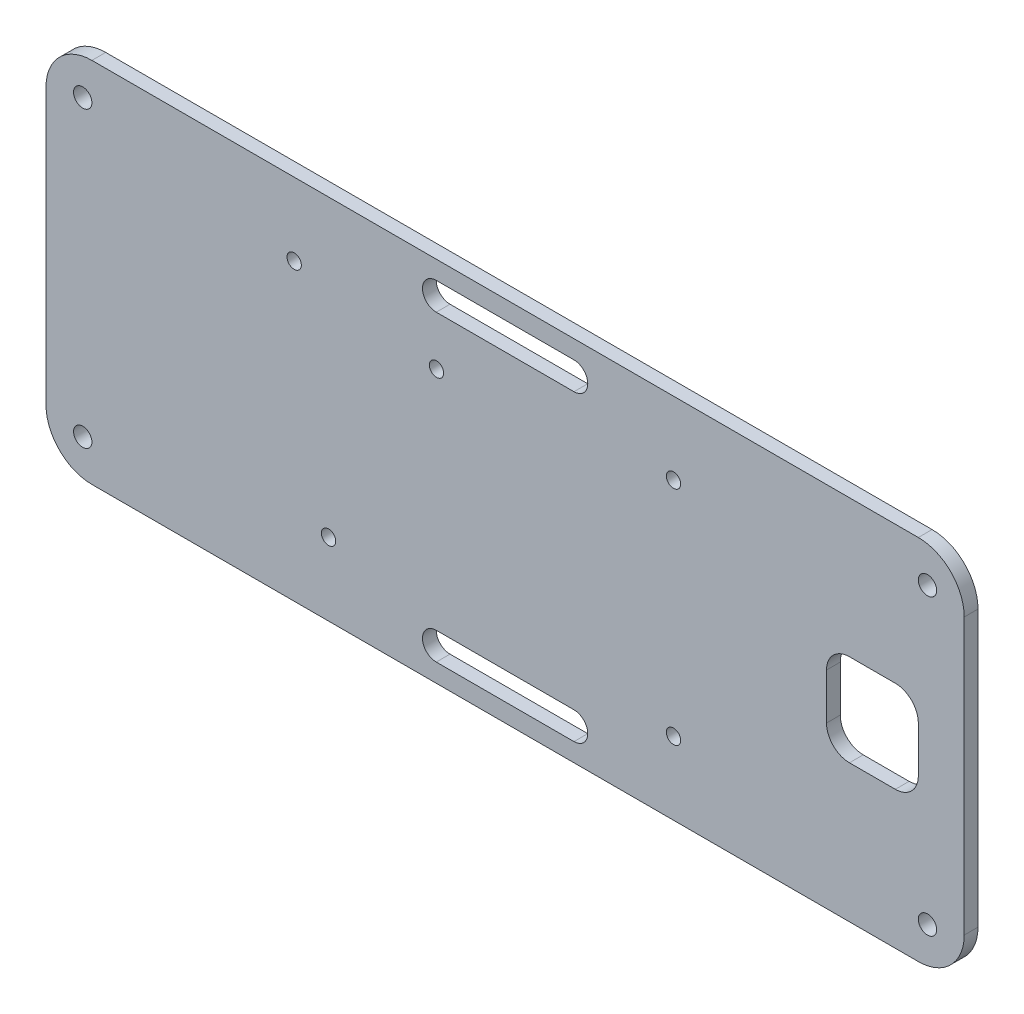
from build123d import *

# Parameters (mm, degrees)
SKETCH1_W           = 200
SKETCH1_H           = 80
BOSS_EXTRUDE1_DEPTH = 3
SKETCH2_R           = 2
CUT_EXTRUDE1_DEPTH  = 108.745069493
FILLET1_R           = 10
SKETCH3_R           = 1.5621
CUT_EXTRUDE2_DEPTH  = 108.745069493
SKETCH4_W           = 20
SKETCH4_H           = 20
CUT_EXTRUDE3_DEPTH  = 108.745069493
FILLET2_R           = 5
CUT_EXTRUDE4_DEPTH  = 108.745069493


with BuildPart() as part:
    # Sketch1 → Boss-Extrude1 (new body)
    with BuildSketch(Plane.XY):
        Rectangle(SKETCH1_W, SKETCH1_H)
    extrude(amount=BOSS_EXTRUDE1_DEPTH)

    # Sketch2 → Cut-Extrude1 (cut, through all)
    with BuildSketch(Plane.XY.offset(3)):
        with Locations((-92, 32)):
            Circle(SKETCH2_R)
        with Locations(Location((-92, -32, 0), (0, 0, 180))):
            Circle(SKETCH2_R)
        with Locations((92, -32)):
            Circle(SKETCH2_R)
        with Locations(Location((92, 32, 0), (0, 0, 180))):
            Circle(SKETCH2_R)
    extrude(amount=-CUT_EXTRUDE1_DEPTH, mode=Mode.SUBTRACT)

    # Fillet1
    fillet1_edges = [part.edges().sort_by_distance(p)[0] for p in [
        (100, -40, 1.5),
        (-100, -40, 1.5),
        (-100, 40, 1.5),
        (100, 40, 1.5),
    ]]
    fillet(fillet1_edges, radius=FILLET1_R)

    # Sketch3 → Cut-Extrude2 (cut, through all)
    with BuildSketch(Plane.XY.offset(3)):
        with Locations((36.6776, 24.1681)):
            Circle(SKETCH3_R)
        with Locations((36.6776, -24.1681)):
            Circle(SKETCH3_R)
        with Locations((-38.4556, -24.1681)):
            Circle(SKETCH3_R)
        with Locations((-45.9486, 24.1681)):
            Circle(SKETCH3_R)
        with Locations((-14.9479, 19.289607234)):
            Circle(SKETCH3_R)
    extrude(amount=-CUT_EXTRUDE2_DEPTH, mode=Mode.SUBTRACT)

    # Sketch4 → Cut-Extrude3 (cut, through all)
    with BuildSketch(Plane.XY.offset(3)):
        with Locations((80, 0)):
            Rectangle(SKETCH4_W, SKETCH4_H)
    extrude(amount=-CUT_EXTRUDE3_DEPTH, mode=Mode.SUBTRACT)

    # Fillet2
    fillet2_edges = [part.edges().sort_by_distance(p)[0] for p in [
        (90, 10, 1.5),
        (90, -10, 1.5),
        (70, -10, 1.5),
        (70, 10, 1.5),
    ]]
    fillet(fillet2_edges, radius=FILLET2_R)

    # Sketch5 → Cut-Extrude4 (cut, through all)
    with BuildSketch(Plane.XY.offset(3)):
        with BuildLine():
            Line((-15, -30), (15, -30))
            ThreePointArc((15, -30), (18, -33), (15, -36))
            Line((15, -36), (-15, -36))
            ThreePointArc((-15, -36), (-18, -33), (-15, -30))
        make_face()
        with BuildLine():
            Line((-15, 30), (15, 30))
            ThreePointArc((15, 30), (18, 33), (15, 36))
            Line((15, 36), (-15, 36))
            ThreePointArc((-15, 36), (-18, 33), (-15, 30))
        make_face()
    extrude(amount=-CUT_EXTRUDE4_DEPTH, mode=Mode.SUBTRACT)


solid = part.part
